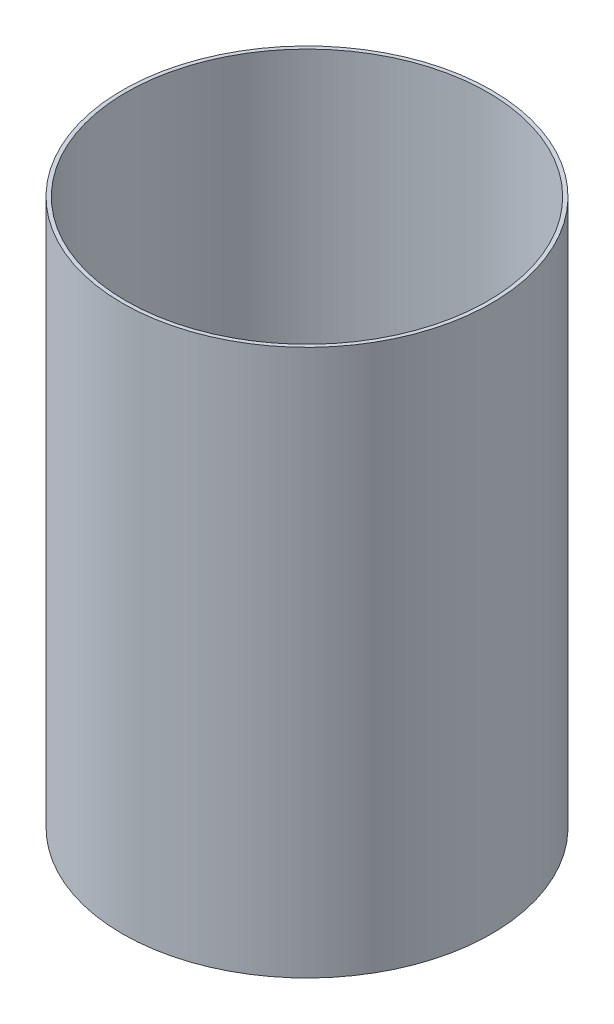
from build123d import *

# Parameters (mm, degrees)
SKETCH1_R           = 248.92
BOSS_EXTRUDE1_DEPTH = 736.6
SKETCH2_R           = 243.84
CUT_EXTRUDE1_DEPTH  = 711.2


with BuildPart() as part:
    # Sketch1 → Boss-Extrude1 (new body)
    with BuildSketch(Plane(origin=(0, 0, 0), x_dir=(1, 0, 0), z_dir=(0, 1, 0))):
        with Locations(Location((0, 0, 0), (0, 0, 270))):
            Circle(SKETCH1_R)
    extrude(amount=BOSS_EXTRUDE1_DEPTH)

    # Sketch2 → Cut-Extrude1 (cut)
    with BuildSketch(Plane(origin=(0, 736.6, 0), x_dir=(1, 0, 0), z_dir=(0, 1, 0))):
        with Locations(Location((0, 0, 0), (0, 0, 270))):
            Circle(SKETCH2_R)
    extrude(amount=-CUT_EXTRUDE1_DEPTH, mode=Mode.SUBTRACT)


solid = part.part
